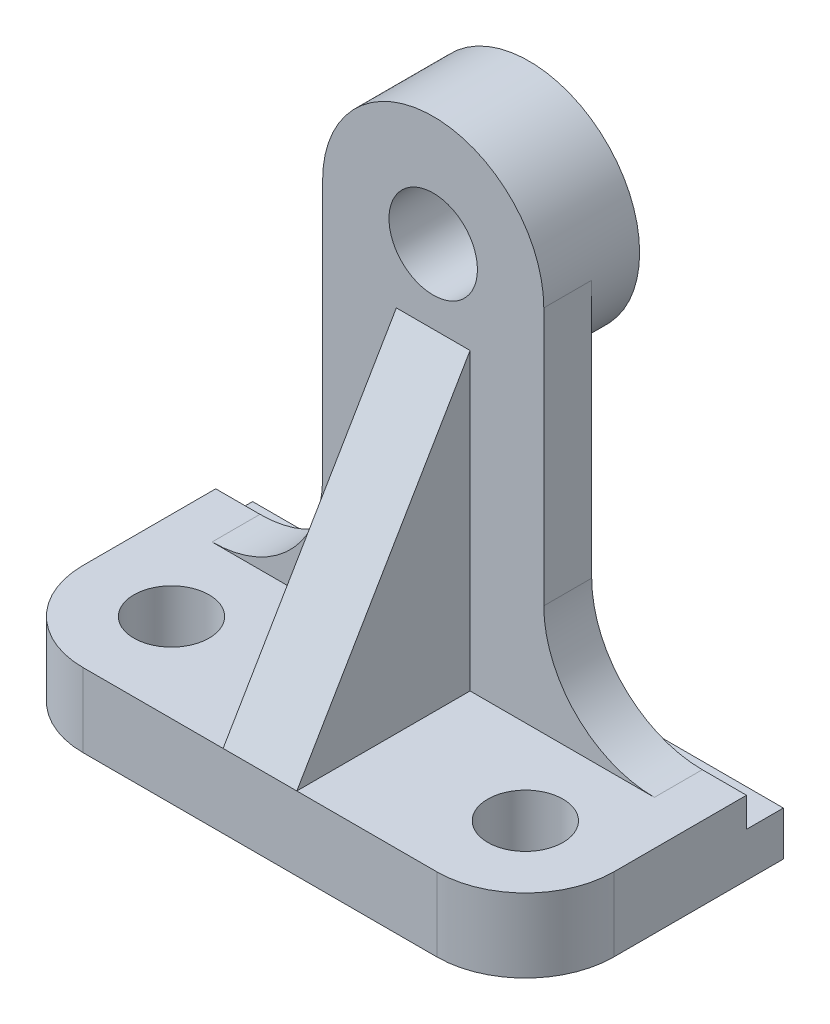
from build123d import *

# Parameters (mm, degrees)
SKETCH1_W           = 72
SKETCH1_H           = 35
SKETCH1_R           = 5.1
BOSS_EXTRUDE1_DEPTH = 10
FILLET1_R           = 12
SKETCH3_W           = 5
SKETCH3_H           = 4
CUT_EXTRUDE1_DEPTH  = 75
SKETCH6_R           = 15
SKETCH6_R_2         = 6
BOSS_EXTRUDE2_DEPTH = 6.5
BOSS_EXTRUDE3_DEPTH = 6.5
FILLET2_R           = 15
BOSS_EXTRUDE4_DEPTH = 5


with BuildPart() as part:
    # Sketch1 → Boss-Extrude1 (new body)
    with BuildSketch(Plane(origin=(0, 0, 0), x_dir=(1, 0, 0), z_dir=(0, 1, 0))):
        Rectangle(SKETCH1_W, SKETCH1_H)
        with Locations((24, -5.5)):
            Circle(SKETCH1_R, mode=Mode.SUBTRACT)
        with Locations((-24, -5.5)):
            Circle(SKETCH1_R, mode=Mode.SUBTRACT)
    extrude(amount=BOSS_EXTRUDE1_DEPTH)

    # Fillet1
    fillet1_edges = [part.edges().sort_by_distance(p)[0] for p in [
        (-36, 5, 17.5),
        (36, 5, 17.5),
    ]]
    fillet(fillet1_edges, radius=FILLET1_R)

    # Sketch3 → Cut-Extrude1 (cut)
    with BuildSketch(Plane.ZY.offset(36)):
        with Locations((-15, 8)):
            Rectangle(SKETCH3_W, SKETCH3_H)
    extrude(amount=-CUT_EXTRUDE1_DEPTH, mode=Mode.SUBTRACT)



with BuildPart() as body_2:
    # Sketch6 → Boss-Extrude2 (new, symmetric)
    with BuildSketch(Plane(origin=(0, 0, -12.5), x_dir=(-1, 0, 0), z_dir=(0, 0, -1))):
        with Locations((0, 60)):
            Circle(SKETCH6_R)
        with Locations((0, 60)):
            Circle(SKETCH6_R_2, mode=Mode.SUBTRACT)
    extrude(amount=BOSS_EXTRUDE2_DEPTH, both=True)


with BuildPart() as part_1:
    add(part.part)

    add(body_2.part)  # Boss-Extrude3 merges body 2
    # Sketch6<3> → Boss-Extrude3 (add)
    with BuildSketch(Plane(origin=(0, 0, -12.5), x_dir=(-1, 0, 0), z_dir=(0, 0, -1))):
        with BuildLine():
            Line((-15, 10), (15, 10))
            Line((15, 10), (15, 60))
            ThreePointArc((15, 60), (0, 45), (-15, 60))
            Line((-15, 60), (-15, 10))
        make_face()
    extrude(amount=-BOSS_EXTRUDE3_DEPTH)

    # Fillet2
    fillet2_edges = [part_1.edges().sort_by_distance(p)[0] for p in [
        (-15, 10, -9.25),
        (15, 10, -9.25),
    ]]
    fillet(fillet2_edges, radius=FILLET2_R)

    # Sketch7 → Boss-Extrude4 (add, symmetric)
    with BuildSketch(Plane(origin=(0, 0, 0), x_dir=(0, 0, -1), z_dir=(1, 0, 0))):
        Polygon((-17.5, 10), (6, 10), (6, 50), align=None)
    extrude(amount=BOSS_EXTRUDE4_DEPTH, both=True)


solid = part_1.part
